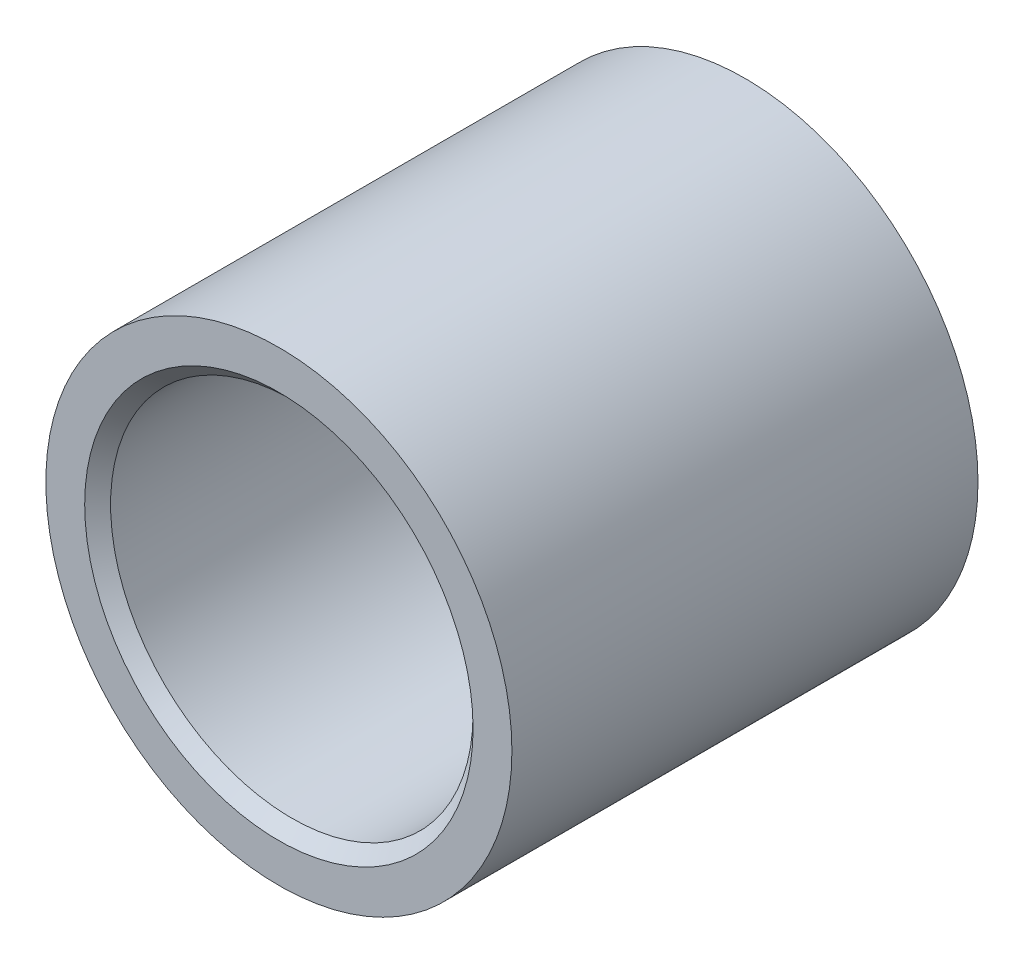
from build123d import *

# Parameters (mm, degrees)
SKETCH1_R           = 18
SKETCH1_R_2         = 14
BOSS_EXTRUDE1_DEPTH = 18
CHAMFER1_SIZE       = 1


with BuildPart() as part:
    # Sketch1 → Boss-Extrude1 (new, symmetric)
    with BuildSketch(Plane.XY):
        Circle(SKETCH1_R)
        Circle(SKETCH1_R_2, mode=Mode.SUBTRACT)
    extrude(amount=BOSS_EXTRUDE1_DEPTH, both=True)

    # Chamfer1
    chamfer1_edges = [part.edges().sort_by_distance(p)[0] for p in [
        (-14, 0, -18),
        (-14, 0, 18),
    ]]
    chamfer(chamfer1_edges, length=CHAMFER1_SIZE)


solid = part.part
